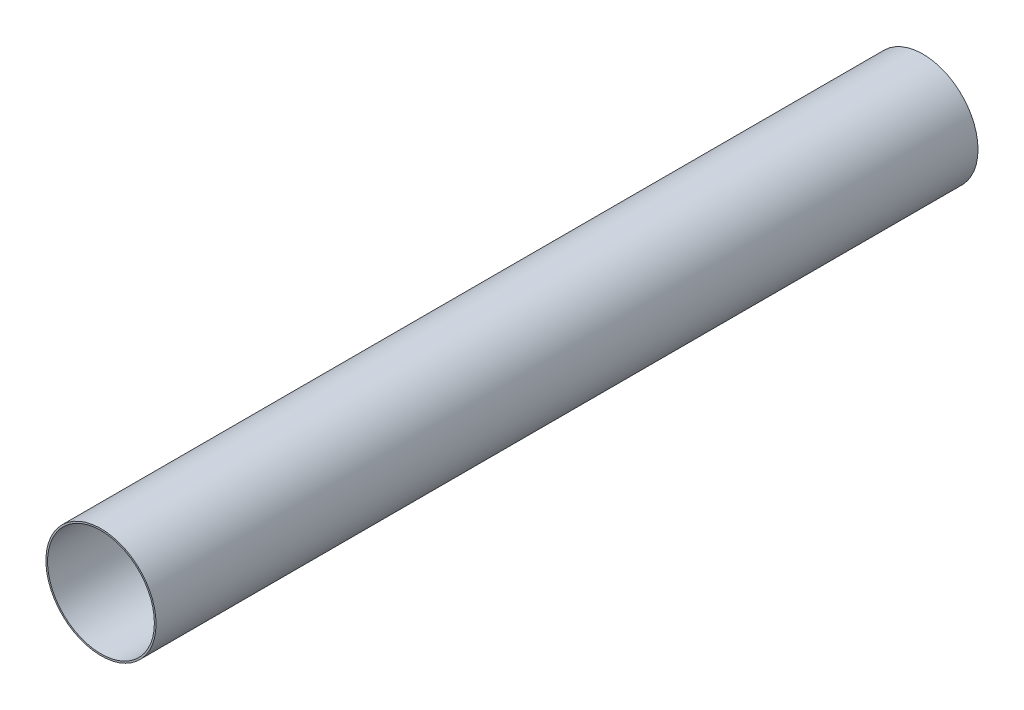
from build123d import *

# Parameters (mm, degrees)
SKETCH1_R           = 51.054
SKETCH1_R_2         = 49.53
BOSS_EXTRUDE1_DEPTH = 762


with BuildPart() as part:
    # Sketch1 → Boss-Extrude1 (new body)
    with BuildSketch(Plane.XY):
        Circle(SKETCH1_R)
        Circle(SKETCH1_R_2, mode=Mode.SUBTRACT)
    extrude(amount=BOSS_EXTRUDE1_DEPTH)


solid = part.part
